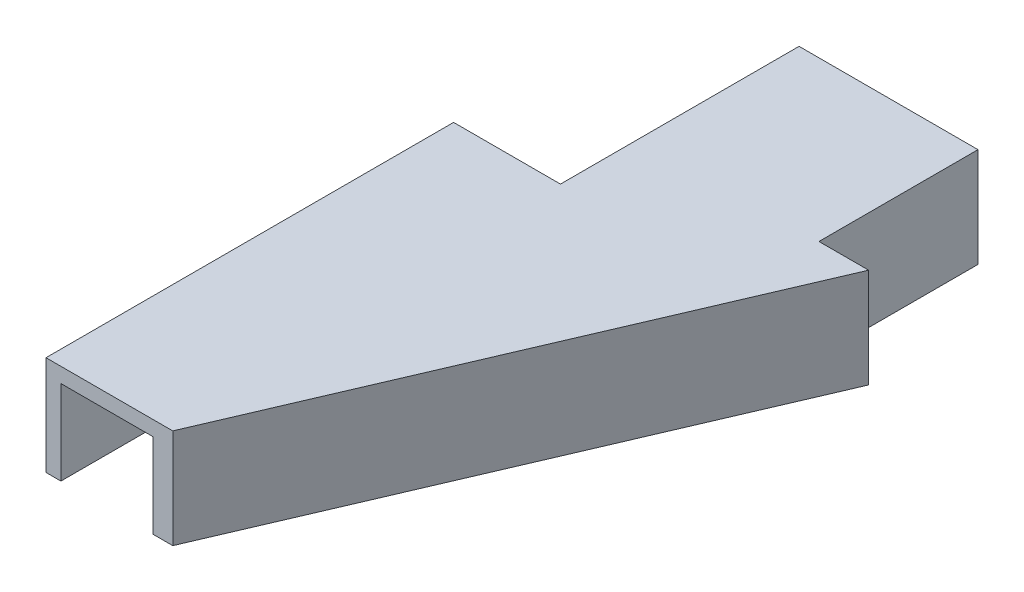
from build123d import *

# Parameters (mm, degrees)
BOSS_EXTRU_1_DEPTH      = 20
BOSS_EXTRU_2_DEPTH      = 85
ESQUISSE4_W             = 50
ESQUISSE4_H             = 20
ENL_V_MAT_EXTRU_1_DEPTH = 47
ENL_V_MAT_EXTRU_2_DEPTH = 17
ESQUISSE6_W             = 21.5
ESQUISSE6_H             = 20
BOSS_EXTRU_3_DEPTH      = 2


with BuildPart() as part:
    # Esquisse1 → Boss.-Extru.1 (new body)
    with BuildSketch(Plane(origin=(0, 0, 0), x_dir=(1, 0, 0), z_dir=(0, 1, 0))):
        Polygon((0, 0), (0, 130), (36, 130), (36, 98), (46, 98), (4, 0), align=None)
    extrude(amount=BOSS_EXTRU_1_DEPTH)

    # Esquisse3 → Boss.-Extru.2 (add)
    with BuildSketch(Plane.XY):
        Polygon((0, 20), (-21.5, 20), (-21.5, 0), (-18.5, 0), (-18.5, 17), (0, 17), align=None)
    extrude(amount=-BOSS_EXTRU_2_DEPTH)

    # Esquisse4 → Enlèv. mat.-Extru.1 (cut)
    with BuildSketch(Plane.ZY):
        with Locations((-105, 10)):
            Rectangle(ESQUISSE4_W, ESQUISSE4_H)
    extrude(amount=ENL_V_MAT_EXTRU_1_DEPTH, mode=Mode.SUBTRACT)

    # Esquisse5 → Enlèv. mat.-Extru.2 (cut)
    with BuildSketch(Plane.XZ):
        Polygon((5, -15.02628851), (5, -125), (31, -125), (31, -93), (38.417304924, -93), align=None)
    extrude(amount=-ENL_V_MAT_EXTRU_2_DEPTH, mode=Mode.SUBTRACT)

    # Esquisse6 → Boss.-Extru.3 (add)
    with BuildSketch(Plane(origin=(0, 0, -80), x_dir=(-1, 0, 0), z_dir=(0, 0, -1))):
        with Locations((10.75, 10)):
            Rectangle(ESQUISSE6_W, ESQUISSE6_H)
    extrude(amount=BOSS_EXTRU_3_DEPTH)


solid = part.part
